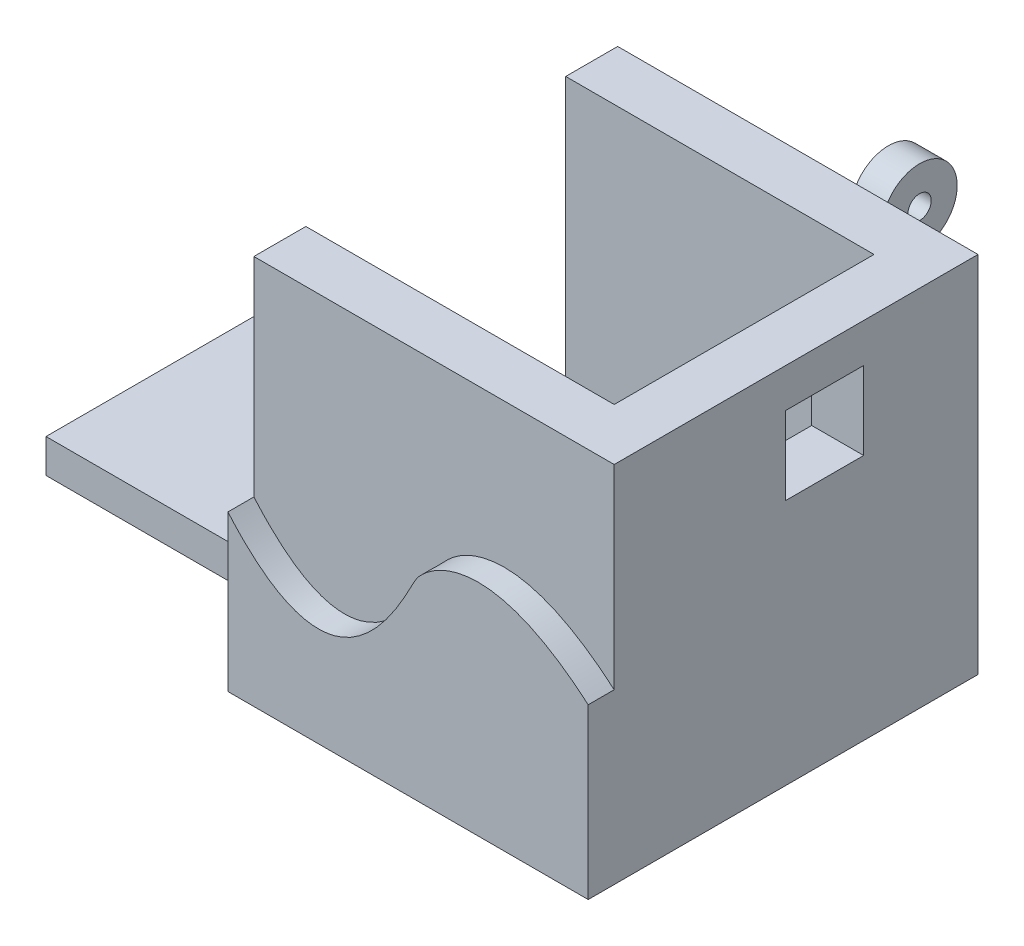
from build123d import *

# Parameters (mm, degrees)
SKETCH_1_W          = 138.66
SKETCH_1_H          = 140
EXTRUDE_1_DEPTH     = 140
SKETCH_2_W          = 118.66
SKETCH_2_H          = 100
CUT_EXTRUDE_1_DEPTH = 110
SKETCH_3_W          = 100
SKETCH_3_H          = 13
EXTRUDE_2_DEPTH     = 100
SKETCH_4_R          = 3
CUT_EXTRUDE_3_DEPTH = 220.026594047
SKETCH_5_W          = 12
SKETCH_5_H          = 12
EXTRUDE_3_DEPTH     = 10
SKETCH_6_R          = 14.490887282
SKETCH_6_R_2        = 4.490887282
EXTRUDE_2_2_DEPTH   = 12
SKETCH_7_R          = 4.490887282
CUT_EXTRUDE_4_DEPTH = 269.968786056
EXTRUDE_4_DEPTH     = 10
SKETCH_10_W         = 30
SKETCH_10_H         = 30
CUT_EXTRUDE_6_DEPTH = 40


with BuildPart() as part:
    # 草圖1 → 填料-伸長1 (new body)
    with BuildSketch(Plane(origin=(0, 0, 0), x_dir=(1, 0, 0), z_dir=(0, 1, 0))):
        Rectangle(SKETCH_1_W, SKETCH_1_H)
    extrude(amount=EXTRUDE_1_DEPTH)

    # 草圖2 → 除料-伸長1 (cut)
    with BuildSketch(Plane(origin=(0, 140, 0), x_dir=(1, 0, 0), z_dir=(0, 1, 0))):
        with Locations((-10, 0)):
            Rectangle(SKETCH_2_W, SKETCH_2_H)
    extrude(amount=-CUT_EXTRUDE_1_DEPTH, mode=Mode.SUBTRACT)

    # 草圖3 → Extrude 2 (add)
    with BuildSketch(Plane.ZY.offset(69.33)):
        with Locations((0, 13.5)):
            Rectangle(SKETCH_3_W, SKETCH_3_H)
    extrude(amount=EXTRUDE_2_DEPTH)

    # 草圖4 → 除料-伸長3 (cut, through all)
    with BuildSketch(Plane(origin=(0, 20, 0), x_dir=(1, 0, 0), z_dir=(0, 1, 0))):
        with Locations(Location((-89.33, 0, 0), (0, 0, 270))):
            Circle(SKETCH_4_R)
    extrude(amount=-CUT_EXTRUDE_3_DEPTH, mode=Mode.SUBTRACT)

    # 草圖5 → 填料-伸長3 (add)
    with BuildSketch(Plane(origin=(0, 0, -70), x_dir=(-1, 0, 0), z_dir=(0, 0, -1))):
        with Locations((-28.33, 126)):
            Rectangle(SKETCH_5_W, SKETCH_5_H)
    extrude(amount=EXTRUDE_3_DEPTH)

    # 草圖6 → Extrude 2 2 (add)
    with BuildSketch(Plane(origin=(34.33, 0, 0), x_dir=(0, 0, -1), z_dir=(1, 0, 0))):
        with Locations((82.5, 132)):
            Circle(SKETCH_6_R)
        with Locations((82.5, 132)):
            Circle(SKETCH_6_R_2, mode=Mode.SUBTRACT)
    extrude(amount=-EXTRUDE_2_2_DEPTH)

    # 草圖7 → 除料-伸長4 (cut, through all)
    with BuildSketch(Plane(origin=(34.33, 0, 0), x_dir=(0, 0, -1), z_dir=(1, 0, 0))):
        with Locations((82.5, 132)):
            Circle(SKETCH_7_R)
    extrude(amount=-CUT_EXTRUDE_4_DEPTH, mode=Mode.SUBTRACT)

    # 草圖8 → 填料-伸長4 (add)
    with BuildSketch(Plane.XY.offset(70)):
        with BuildLine():
            Line((69.33, 64.932058031), (69.33, 0))
            Line((69.33, 0), (-69.33, 0))
            Line((-69.33, 0), (-69.33, 59.86))
            add(Edge.make_bspline(
                [(-69.33, 59.86), (-30.324326289, 14.723815627), (-7.370352849, 53.302477249), (5.662490983, 78.887059451), (32.075816325, 96.876157593), (69.33, 64.932058031)],
                knots=[0, 0, 0, 0, 0.759134607, 0.799849306, 1, 1, 1, 1], degree=3))
        make_face()
    extrude(amount=EXTRUDE_4_DEPTH)

    # 草圖10 → 除料-伸長6 (cut)
    with BuildSketch(Plane.ZY.offset(-49.33)):
        with Locations((-11, 110)):
            Rectangle(SKETCH_10_W, SKETCH_10_H)
    extrude(amount=-CUT_EXTRUDE_6_DEPTH, mode=Mode.SUBTRACT)


solid = part.part
